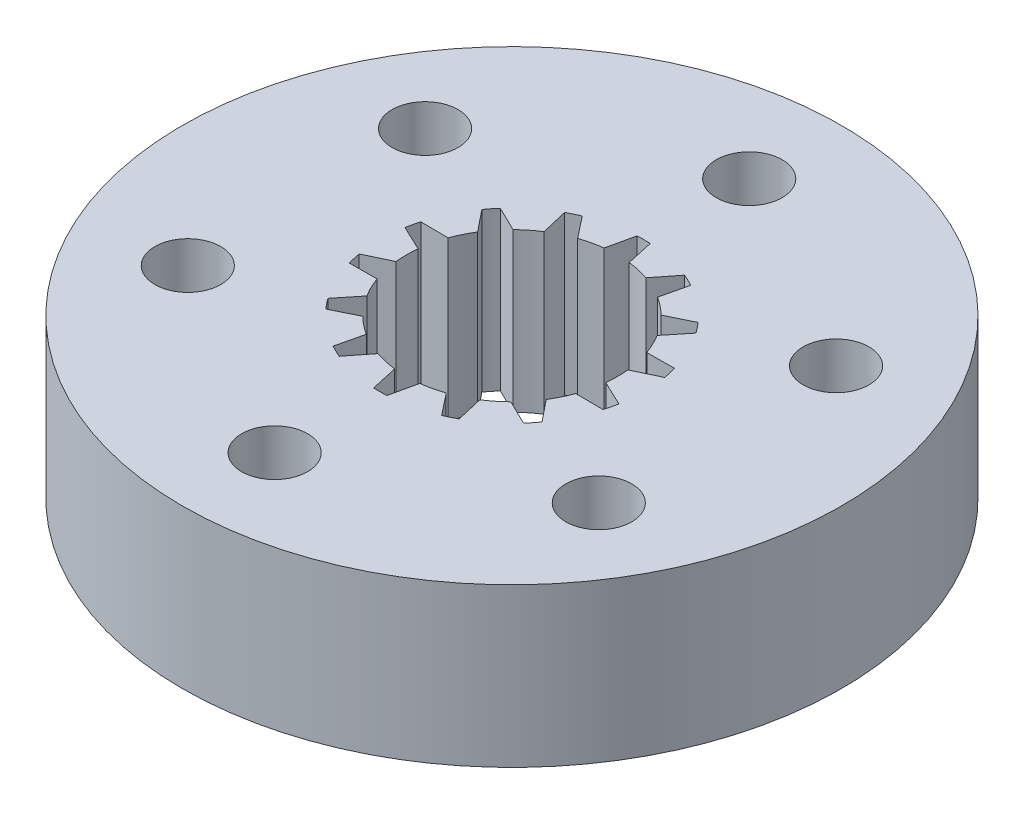
from build123d import *

# Parameters (mm, degrees)
SKETCH1_R           = 12.5
BOSS_EXTRUDE1_DEPTH = 6
M3_TAPPED_HOLE1_D   = 2.5


with BuildPart() as part:
    # Sketch1 → Boss-Extrude1 (new body)
    with BuildSketch(Plane(origin=(0, 0, 0), x_dir=(1, 0, 0), z_dir=(0, 1, 0))):
        with Locations(Location((0, 0, 0), (0, 0, 270))):
            Circle(SKETCH1_R)
        with BuildLine():
            Line((-0.25, 4.993746089), (-0.476626074, 3.971501931))
            ThreePointArc((-0.476626074, 3.971501931), (-0.890083736, 3.899711649), (-1.293744854, 3.784999901))
            Line((-1.293744854, 3.784999901), (-1.941463008, 4.607680695))
            ThreePointArc((-1.941463008, 4.607680695), (-2.169418696, 4.50484434), (-2.391947442, 4.390738825))
            Line((-2.391947442, 4.390738825), (-2.152595362, 3.371399295))
            ThreePointArc((-2.152595362, 3.371399295), (-2.493959207, 3.12732593), (-2.807873746, 2.848832222))
            Line((-2.807873746, 2.848832222), (-3.748395457, 3.30900763))
            ThreePointArc((-3.748395457, 3.30900763), (-3.909157412, 3.117449009), (-4.060140358, 2.918091889))
            Line((-4.060140358, 2.918091889), (-3.402216738, 2.103549682))
            ThreePointArc((-3.402216738, 2.103549682), (-3.603875472, 1.735534956), (-3.765868806, 1.348418382))
            Line((-3.765868806, 1.348418382), (-4.812912215, 1.354945022))
            ThreePointArc((-4.812912215, 1.354945022), (-4.874639561, 1.11260467), (-4.924172682, 0.867481066))
            Line((-4.924172682, 0.867481066), (-3.977987365, 0.419066256))
            ThreePointArc((-3.977987365, 0.419066256), (-4, 0), (-3.977987365, -0.419066256))
            Line((-3.977987365, -0.419066256), (-4.924172682, -0.867481066))
            ThreePointArc((-4.924172682, -0.867481066), (-4.874639561, -1.11260467), (-4.812912215, -1.354945022))
            Line((-4.812912215, -1.354945022), (-3.765868806, -1.348418382))
            ThreePointArc((-3.765868806, -1.348418382), (-3.603875472, -1.735534956), (-3.402216738, -2.103549682))
            Line((-3.402216738, -2.103549682), (-4.060140358, -2.918091889))
            ThreePointArc((-4.060140358, -2.918091889), (-3.909157412, -3.117449009), (-3.748395457, -3.30900763))
            Line((-3.748395457, -3.30900763), (-2.807873746, -2.848832222))
            ThreePointArc((-2.807873746, -2.848832222), (-2.493959207, -3.12732593), (-2.152595362, -3.371399295))
            Line((-2.152595362, -3.371399295), (-2.391947442, -4.390738825))
            ThreePointArc((-2.391947442, -4.390738825), (-2.169418696, -4.50484434), (-1.941463008, -4.607680695))
            Line((-1.941463008, -4.607680695), (-1.293744854, -3.784999901))
            ThreePointArc((-1.293744854, -3.784999901), (-0.890083736, -3.899711649), (-0.476626074, -3.971501931))
            Line((-0.476626074, -3.971501931), (-0.25, -4.993746089))
            ThreePointArc((-0.25, -4.993746089), (0, -5), (0.25, -4.993746089))
            Line((0.25, -4.993746089), (0.476626074, -3.971501931))
            ThreePointArc((0.476626074, -3.971501931), (0.890083736, -3.899711649), (1.293744854, -3.784999901))
            Line((1.293744854, -3.784999901), (1.941463008, -4.607680695))
            ThreePointArc((1.941463008, -4.607680695), (2.169418696, -4.50484434), (2.391947442, -4.390738825))
            Line((2.391947442, -4.390738825), (2.152595362, -3.371399295))
            ThreePointArc((2.152595362, -3.371399295), (2.493959207, -3.12732593), (2.807873746, -2.848832222))
            Line((2.807873746, -2.848832222), (3.748395457, -3.30900763))
            ThreePointArc((3.748395457, -3.30900763), (3.909157412, -3.117449009), (4.060140358, -2.918091889))
            Line((4.060140358, -2.918091889), (3.402216738, -2.103549682))
            ThreePointArc((3.402216738, -2.103549682), (3.603875472, -1.735534956), (3.765868806, -1.348418382))
            Line((3.765868806, -1.348418382), (4.812912215, -1.354945022))
            ThreePointArc((4.812912215, -1.354945022), (4.874639561, -1.11260467), (4.924172682, -0.867481066))
            Line((4.924172682, -0.867481066), (3.977987365, -0.419066256))
            ThreePointArc((3.977987365, -0.419066256), (4, 0), (3.977987365, 0.419066256))
            Line((3.977987365, 0.419066256), (4.924172682, 0.867481066))
            ThreePointArc((4.924172682, 0.867481066), (4.874639561, 1.11260467), (4.812912215, 1.354945022))
            Line((4.812912215, 1.354945022), (3.765868806, 1.348418382))
            ThreePointArc((3.765868806, 1.348418382), (3.603875472, 1.735534956), (3.402216738, 2.103549682))
            Line((3.402216738, 2.103549682), (4.060140358, 2.918091889))
            ThreePointArc((4.060140358, 2.918091889), (3.909157412, 3.117449009), (3.748395457, 3.30900763))
            Line((3.748395457, 3.30900763), (2.807873746, 2.848832222))
            ThreePointArc((2.807873746, 2.848832222), (2.493959207, 3.12732593), (2.152595362, 3.371399295))
            Line((2.152595362, 3.371399295), (2.391947442, 4.390738825))
            ThreePointArc((2.391947442, 4.390738825), (2.169418696, 4.50484434), (1.941463008, 4.607680695))
            Line((1.941463008, 4.607680695), (1.293744854, 3.784999901))
            ThreePointArc((1.293744854, 3.784999901), (0.890083736, 3.899711649), (0.476626074, 3.971501931))
            Line((0.476626074, 3.971501931), (0.25, 4.993746089))
            ThreePointArc((0.25, 4.993746089), (0, 5), (-0.25, 4.993746089))
        make_face(mode=Mode.SUBTRACT)
    extrude(amount=BOSS_EXTRUDE1_DEPTH)

    # M3 Tapped Hole1 (through all)
    with Locations(Plane(origin=(0, 6, 0), x_dir=(1, 0, 0), z_dir=(0, 1, 0))):
        with Locations((0, 9), (7.794228634, 4.5), (7.794228634, -4.5), (0, -9), (-7.794228634, -4.5), (-7.794228634, 4.5)):
            Hole(M3_TAPPED_HOLE1_D / 2)


solid = part.part
